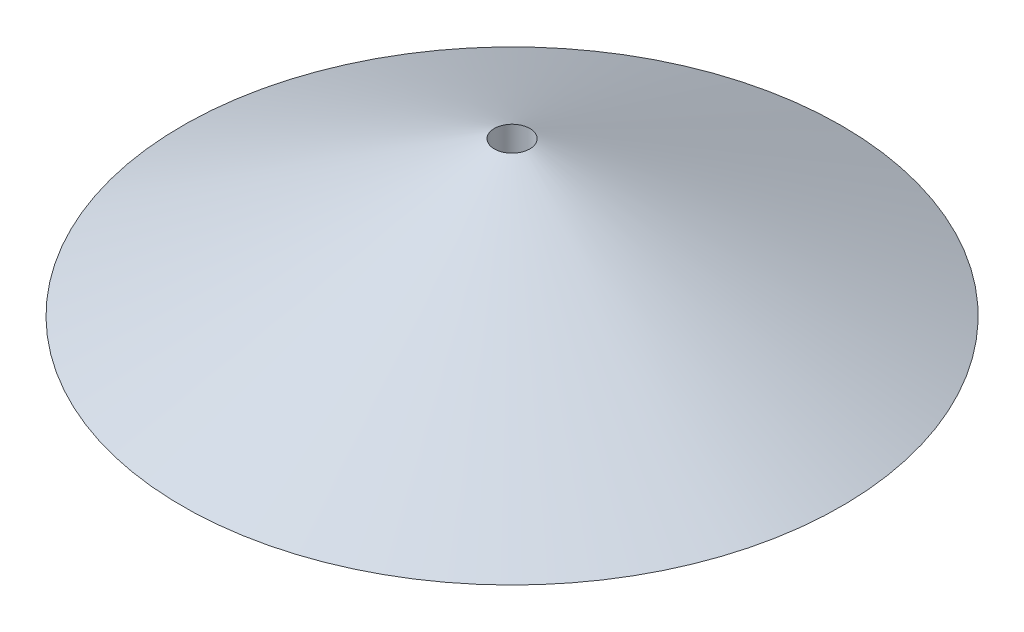
from build123d import *

# Parameters (mm, degrees)
SKETCH4_R          = 1.75
CUT_EXTRUDE1_DEPTH = 49.66723744


with BuildPart() as part:
    # Sketch3 → Revolve5 (revolve)
    with BuildSketch(Plane(origin=(0, 0, 0), x_dir=(0, 0, -1), z_dir=(1, 0, 0))):
        Polygon((0, 0), (32.5, 0), (0, 16), align=None)
    revolve(axis=Axis((0, 0, 0), (0, 1, 0)))

    # Sketch4 → Cut-Extrude1 (cut, through all)
    with BuildSketch(Plane.XZ):
        with Locations(Location((0, 0, 0), (0, 0, 270))):
            Circle(SKETCH4_R)
    extrude(amount=-CUT_EXTRUDE1_DEPTH, mode=Mode.SUBTRACT)


solid = part.part
